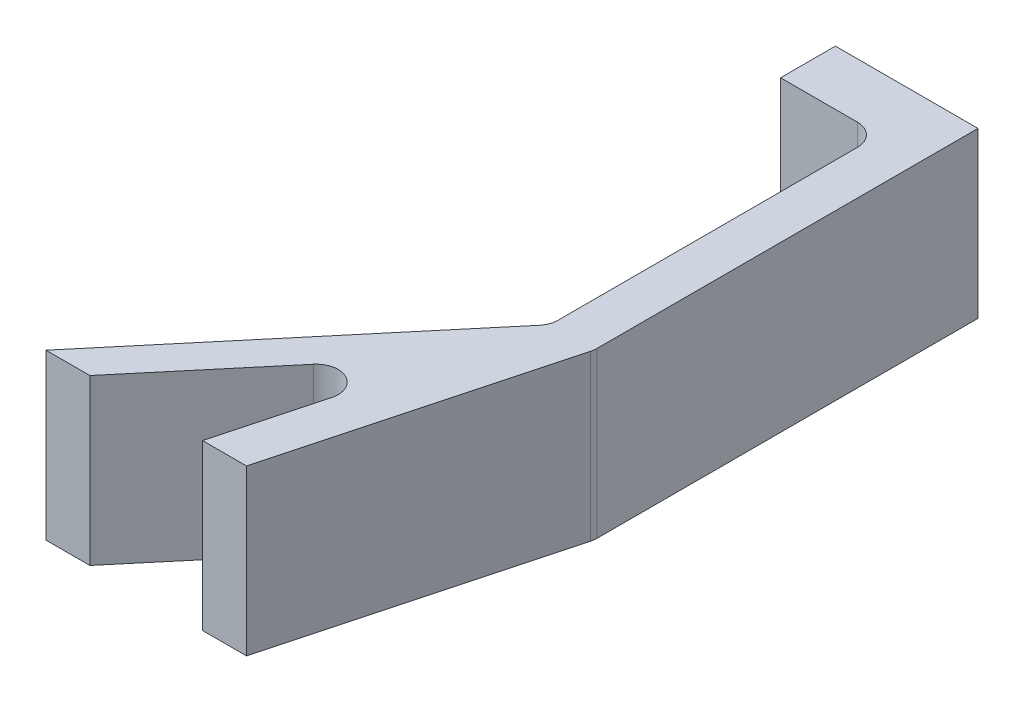
from build123d import *

# Parameters (mm, degrees)
BOSS_EXTRUDE1_DEPTH = 15
CUT_EXTRUDE2_DEPTH  = 10
FILLET2_R           = 2


with BuildPart() as part:
    # Sketch1 → Boss-Extrude1 (new body)
    with BuildSketch(Plane(origin=(0, 0, 0), x_dir=(1, 0, 0), z_dir=(0, 1, 0))):
        Polygon((-2, 0), (-2, 30), (-11, 30), (-11, 35), (2, 35), (2, 30), (2, 0), (-4.698729811, -25), (-8.698729811, -25), (-3.876557728, -7.003408785), (-18.977490779, -25), (-22.977490779, -25), align=None)
    extrude(amount=BOSS_EXTRUDE1_DEPTH)

    # Sketch3 → Cut-Extrude2 (cut)
    with BuildSketch(Plane(origin=(0, 0, -35), x_dir=(-1, 0, 0), z_dir=(0, 0, -1))):
        with BuildLine():
            ThreePointArc((8.85, 7.5), (8.611041293, 8.341169779), (7.965541753, 8.931083506))
            Line((7.965541753, 8.931083506), (6.534458247, 6.068916494))
            ThreePointArc((6.534458247, 6.068916494), (8.091169779, 6.138958707), (8.85, 7.5))
        make_face()
        with BuildLine():
            Line((6.534458247, 6.068916494), (7.965541753, 8.931083506))
            ThreePointArc((7.965541753, 8.931083506), (5.818916494, 8.215541753), (6.534458247, 6.068916494))
        make_face()
    extrude(amount=-CUT_EXTRUDE2_DEPTH, mode=Mode.SUBTRACT)

    # Fillet2
    fillet2_edges = [part.edges().sort_by_distance(p)[0] for p in [
        (-2, 7.5, 0),
        (-2, 7.5, -30),
        (2, 7.5, 0),
        (-3.876557728, 7.5, 7.003408785),
    ]]
    fillet(fillet2_edges, radius=FILLET2_R)


solid = part.part
